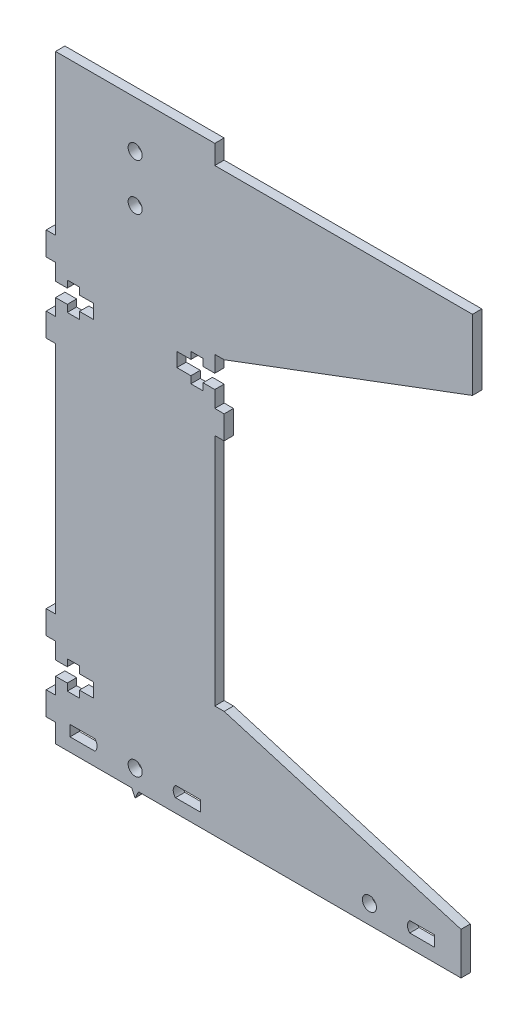
from build123d import *

# Parameters (mm, degrees)
SKETCH_1_R      = 1.5
EXTRUDE_1_DEPTH = 2


with BuildPart() as part:
    # 草图1 → 凸台-拉伸1 (new body)
    with BuildSketch(Plane.XY):
        Polygon((16.993865071, 15.9), (16.993865071, 20), (-16.993865071, 20), (-16.993865071, 15.9), (-16.993865071, -14), (-18.993865071, -14), (-18.993865071, -19), (-16.993865071, -19), (-16.993865071, -22.5), (-14.493865071, -22.5), (-14.493865071, -21), (-11.893865071, -21), (-11.893865071, -22.5), (-8.893865071, -22.5), (-8.893865071, -25.5), (-11.893865071, -25.5), (-11.893865071, -27), (-14.493865071, -27), (-14.493865071, -25.5), (-16.993865071, -25.5), (-16.993865071, -29), (-18.993865071, -29), (-18.993865071, -34), (-16.993865071, -34), (-16.993865071, -84), (-18.993865071, -84), (-18.993865071, -89), (-16.993865071, -89), (-16.993865071, -92.5), (-14.493865071, -92.5), (-14.493865071, -91), (-11.893865071, -91), (-11.893865071, -92.5), (-8.893865071, -92.5), (-8.893865071, -95.5), (-11.893865071, -95.5), (-11.893865071, -97), (-14.493865071, -97), (-14.493865071, -95.5), (-16.993865071, -95.5), (-16.993865071, -99), (-18.993865071, -99), (-18.993865071, -104), (-16.993865071, -104), (-16.993865071, -108), (-0.721190694, -108), (0, -109.5), (0.721190694, -108), (16.993865071, -108), (69.553865071, -108), (69.553865071, -105), (69.553865071, -99), (18.993865071, -84), (16.993865071, -84), (16.993865071, -34), (18.993865071, -34), (18.993865071, -29), (16.993865071, -29), (16.993865071, -25.5), (14.493865071, -25.5), (14.493865071, -27), (11.893865071, -27), (11.893865071, -25.5), (8.893865071, -25.5), (8.893865071, -22.5), (11.893865071, -22.5), (11.893865071, -21), (14.493865071, -21), (14.493865071, -22.5), (16.993865071, -22.5), (16.993865071, -19), (18.993865071, -19), (71.993865071, 0.9), (71.993865071, 15.9), align=None)
        with Locations((0, -104)):
            Circle(SKETCH_1_R, mode=Mode.SUBTRACT)
        Circle(SKETCH_1_R, mode=Mode.SUBTRACT)
        with Locations((0, 10)):
            Circle(SKETCH_1_R, mode=Mode.SUBTRACT)
        with Locations((50, -104)):
            Circle(SKETCH_1_R, mode=Mode.SUBTRACT)
        with BuildLine():
            Line((13.9, -105.15), (8.6, -105.15))
            ThreePointArc((8.6, -105.15), (8.123654403, -104), (8.6, -102.85))
            Line((8.6, -102.85), (13.9, -102.85))
            Line((13.9, -102.85), (13.9, -105.15))
        make_face(mode=Mode.SUBTRACT)
        with BuildLine():
            Line((-13.9, -102.85), (-8.6, -102.85))
            ThreePointArc((-8.6, -102.85), (-8.123654403, -104), (-8.6, -105.15))
            Line((-8.6, -105.15), (-13.9, -105.15))
            Line((-13.9, -105.15), (-13.9, -102.85))
        make_face(mode=Mode.SUBTRACT)
        with BuildLine():
            Line((63.9, -105.15), (58.6, -105.15))
            ThreePointArc((58.6, -105.15), (58.123654403, -104), (58.6, -102.85))
            Line((58.6, -102.85), (63.9, -102.85))
            Line((63.9, -102.85), (63.9, -105.15))
        make_face(mode=Mode.SUBTRACT)
    extrude(amount=EXTRUDE_1_DEPTH)


solid = part.part
